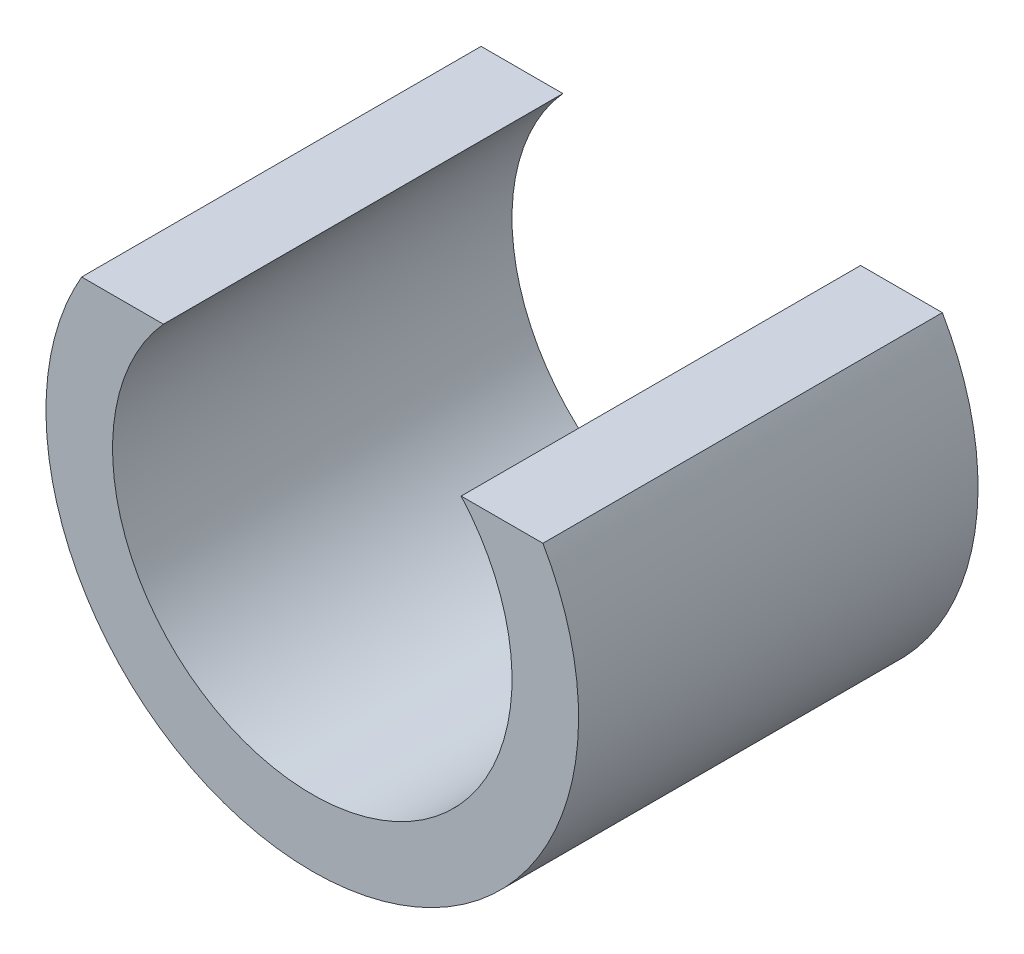
from build123d import *

# Parameters (mm, degrees)
SKETCH1_R      = 2
EXTRUDE1_DEPTH = 3
SKETCH3_R      = 1.5
SKETCH3_W      = 4.104286597
SKETCH3_H      = 1.159075001
EXTRUDE3_DEPTH = 3


with BuildPart() as part:
    # Sketch1 → Extrude1 (new body)
    with BuildSketch(Plane.XY):
        Circle(SKETCH1_R)
    extrude(amount=EXTRUDE1_DEPTH)

    # Sketch3 → Extrude3 (cut)
    with BuildSketch(Plane.XY.offset(3)):
        Circle(SKETCH3_R)
        with Locations((0.008550597, 1.579537501)):
            Rectangle(SKETCH3_W, SKETCH3_H)
    extrude(amount=-EXTRUDE3_DEPTH, mode=Mode.SUBTRACT)


solid = part.part
